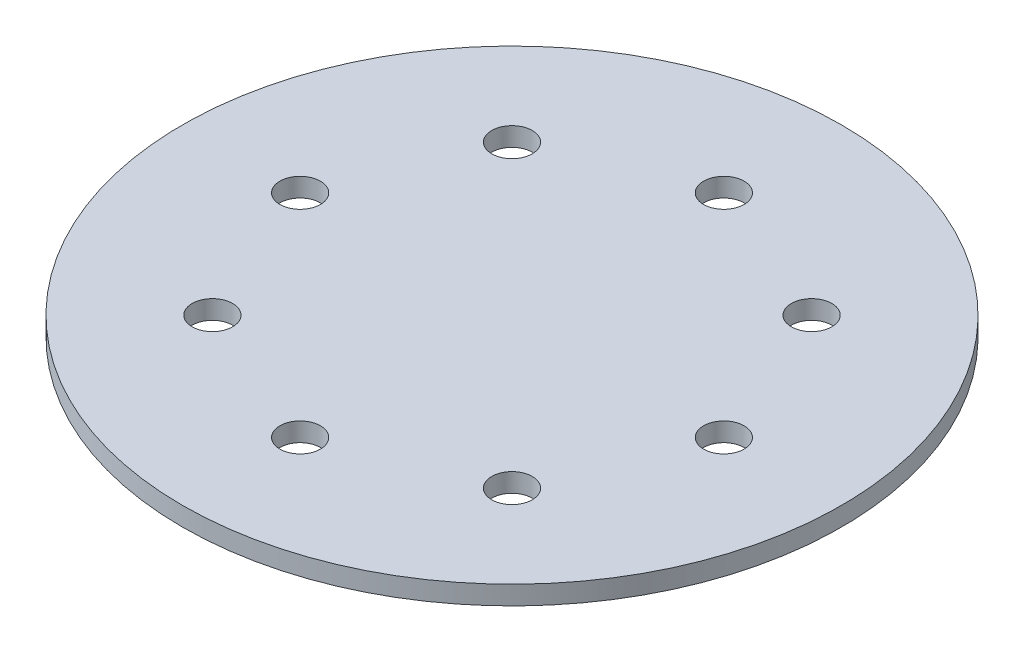
from build123d import *

# Parameters (mm, degrees)
SKETCH1_R           = 35
BOSS_EXTRUDE1_DEPTH = 2
SKETCH2_R           = 2.15
CUT_EXTRUDE1_DEPTH  = 2
CIRPATTERN1_COUNT   = 8


with BuildPart() as part:
    # Sketch1 → Boss-Extrude1 (new body)
    with BuildSketch(Plane(origin=(0, 0, 0), x_dir=(1, 0, 0), z_dir=(0, 1, 0))):
        with Locations(Location((0, 0, 0), (0, 0, 270))):
            Circle(SKETCH1_R)
    extrude(amount=BOSS_EXTRUDE1_DEPTH)

    # Sketch2 → Cut-Extrude1 (cut)
    with BuildSketch(Plane(origin=(0, 2, 0), x_dir=(1, 0, 0), z_dir=(0, 1, 0))):
        with Locations(Location((0, 22.5, 0), (0, 0, 270))):
            Circle(SKETCH2_R)
    cut_extrude1 = extrude(amount=-CUT_EXTRUDE1_DEPTH, mode=Mode.SUBTRACT)

    # CirPattern1: Cut-Extrude1 ×8 about axis
    cirpattern1_axis = Axis((0, 0, 0), (0, 1, 0))
    for i in range(1, CIRPATTERN1_COUNT):
        add(cut_extrude1.rotate(cirpattern1_axis, i * 360 / CIRPATTERN1_COUNT), mode=Mode.SUBTRACT)


solid = part.part
